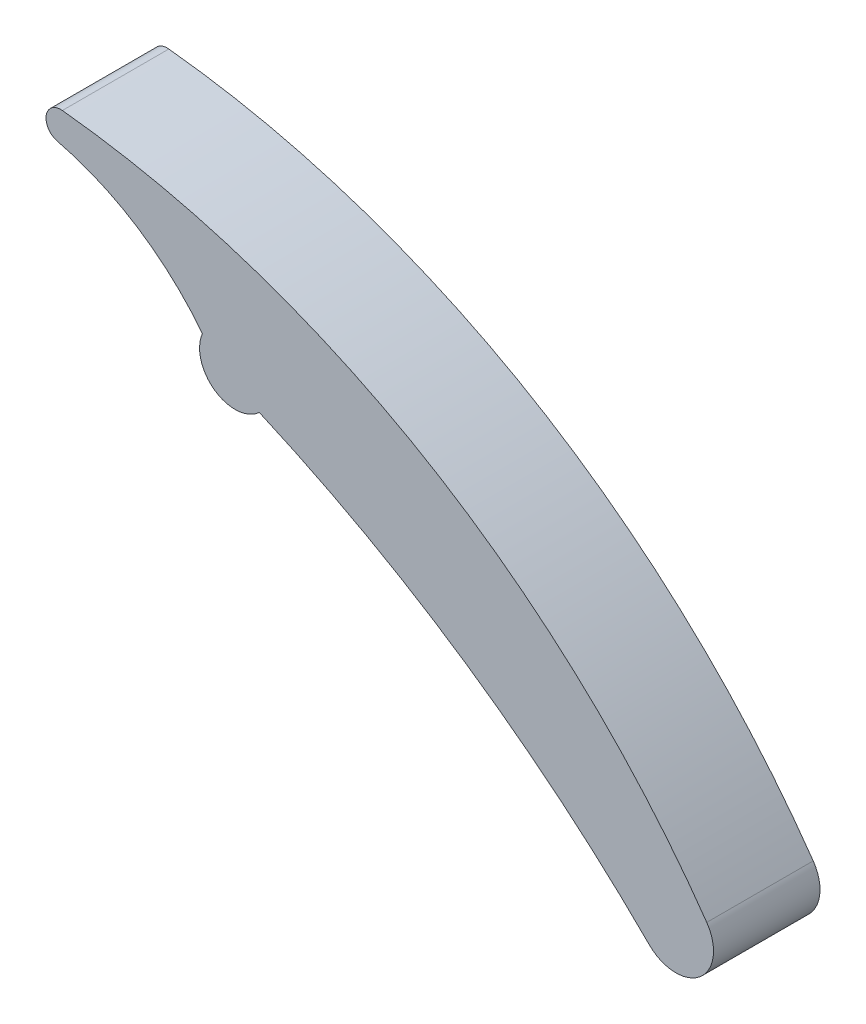
from build123d import *

# Parameters (mm, degrees)
EXTRUDE_1_DEPTH = 15


with BuildPart() as part:
    # 草图2 → 凸台-拉伸1 (new, symmetric)
    with BuildSketch(Plane.XY):
        with BuildLine():
            ThreePointArc((-50.101760938, 30.428374824), (-53.212480705, 35.199792857), (-48.662053388, 38.625667744))
            ThreePointArc((-48.662053388, 38.625667744), (53.783376909, 4.667316575), (132.921228365, -68.718215172))
            ThreePointArc((132.921228365, -68.718215172), (131.035363994, -82.914699935), (116.728010512, -82.285175988))
            ThreePointArc((116.728010512, -82.285175988), (65.281465021, -39.655460148), (6.814778353, -7.318387527))
            ThreePointArc((6.814778353, -7.318387527), (-5.74124488, -8.18768021), (-9.202597166, 3.913081318))
            ThreePointArc((-9.202597166, 3.913081318), (-27.419137904, 20.615137073), (-50.101760938, 30.428374824))
        make_face()
    extrude(amount=EXTRUDE_1_DEPTH, both=True)


solid = part.part
